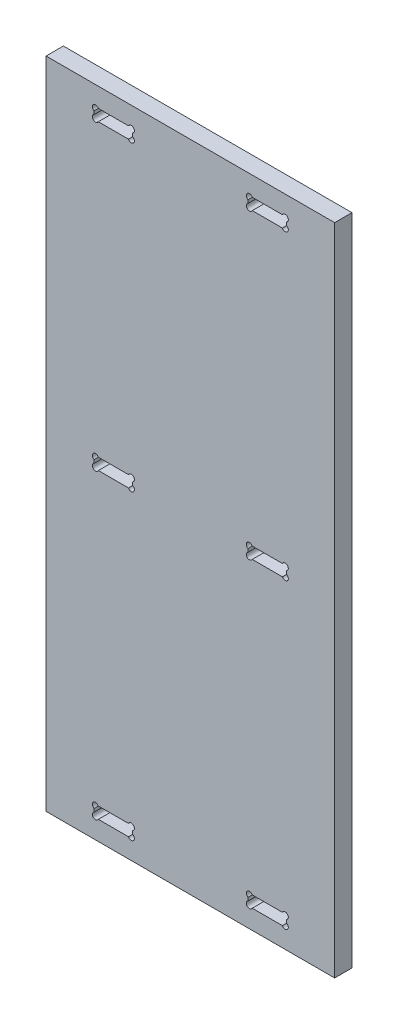
from build123d import *

# Parameters (mm, degrees)
BOSS_EXTRUDE1_DEPTH = 18


with BuildPart() as part:
    # Sketch1 → Boss-Extrude1 (new body)
    with BuildSketch(Plane.XY):
        Polygon((1280.062211089, 3439.241832817), (1280.062211089, 3419.241832817), (1280.062211089, 3407.241832817), (1280.062211089, 3105.241832817), (1280.062211089, 3093.241832817), (1280.062211089, 2791.241832817), (1280.062211089, 2779.241832817), (1280.062211089, 2759.241832817), (1580.062211089, 2759.241832817), (1580.062211089, 2779.241832817), (1580.062211089, 2791.241832817), (1580.062211089, 3093.241832817), (1580.062211089, 3105.241832817), (1580.062211089, 3407.241832817), (1580.062211089, 3419.241832817), (1580.062211089, 3439.241832817), align=None)
        with BuildLine():
            Line((1525.721822549, 3093.241832817), (1494.402599629, 3093.241832817))
            ThreePointArc((1494.402599629, 3093.241832817), (1489.178327612, 3092.357949341), (1490.062211089, 3097.582221357))
            Line((1490.062211089, 3097.582221357), (1490.062211089, 3100.901444277))
            ThreePointArc((1490.062211089, 3100.901444277), (1489.178327612, 3106.125716294), (1494.402599629, 3105.241832817))
            Line((1494.402599629, 3105.241832817), (1525.721822549, 3105.241832817))
            ThreePointArc((1525.721822549, 3105.241832817), (1530.946094565, 3106.125716294), (1530.062211089, 3100.901444277))
            Line((1530.062211089, 3100.901444277), (1530.062211089, 3097.582221357))
            ThreePointArc((1530.062211089, 3097.582221357), (1530.946094565, 3092.357949341), (1525.721822549, 3093.241832817))
        make_face(mode=Mode.SUBTRACT)
        with BuildLine():
            Line((1365.721822549, 2791.241832817), (1334.402599629, 2791.241832817))
            ThreePointArc((1334.402599629, 2791.241832817), (1329.178327612, 2792.125716294), (1330.062211089, 2786.901444277))
            Line((1330.062211089, 2786.901444277), (1330.062211089, 2783.582221357))
            ThreePointArc((1330.062211089, 2783.582221357), (1329.178327612, 2778.357949341), (1334.402599629, 2779.241832817))
            Line((1334.402599629, 2779.241832817), (1365.721822549, 2779.241832817))
            ThreePointArc((1365.721822549, 2779.241832817), (1370.946094565, 2778.357949341), (1370.062211089, 2783.582221357))
            Line((1370.062211089, 2783.582221357), (1370.062211089, 2786.901444277))
            ThreePointArc((1370.062211089, 2786.901444277), (1370.946094565, 2792.125716294), (1365.721822549, 2791.241832817))
        make_face(mode=Mode.SUBTRACT)
        with BuildLine():
            Line((1330.062211089, 3414.901444277), (1330.062211089, 3411.582221357))
            ThreePointArc((1330.062211089, 3411.582221357), (1329.178327612, 3406.357949341), (1334.402599629, 3407.241832817))
            Line((1334.402599629, 3407.241832817), (1365.721822549, 3407.241832817))
            ThreePointArc((1365.721822549, 3407.241832817), (1370.946094565, 3406.357949341), (1370.062211089, 3411.582221357))
            Line((1370.062211089, 3411.582221357), (1370.062211089, 3414.901444277))
            ThreePointArc((1370.062211089, 3414.901444277), (1370.946094565, 3420.125716294), (1365.721822549, 3419.241832817))
            Line((1365.721822549, 3419.241832817), (1334.402599629, 3419.241832817))
            ThreePointArc((1334.402599629, 3419.241832817), (1329.178327612, 3420.125716294), (1330.062211089, 3414.901444277))
        make_face(mode=Mode.SUBTRACT)
        with BuildLine():
            Line((1334.402599629, 3105.241832817), (1365.721822549, 3105.241832817))
            ThreePointArc((1365.721822549, 3105.241832817), (1370.946094565, 3106.125716294), (1370.062211089, 3100.901444277))
            Line((1370.062211089, 3100.901444277), (1370.062211089, 3097.582221357))
            ThreePointArc((1370.062211089, 3097.582221357), (1370.946094565, 3092.357949341), (1365.721822549, 3093.241832817))
            Line((1365.721822549, 3093.241832817), (1334.402599629, 3093.241832817))
            ThreePointArc((1334.402599629, 3093.241832817), (1329.178327612, 3092.357949341), (1330.062211089, 3097.582221357))
            Line((1330.062211089, 3097.582221357), (1330.062211089, 3100.901444277))
            ThreePointArc((1330.062211089, 3100.901444277), (1329.178327612, 3106.125716294), (1334.402599629, 3105.241832817))
        make_face(mode=Mode.SUBTRACT)
        with BuildLine():
            Line((1530.062211089, 2783.582221357), (1530.062211089, 2786.901444277))
            ThreePointArc((1530.062211089, 2786.901444277), (1530.946094565, 2792.125716294), (1525.721822549, 2791.241832817))
            Line((1525.721822549, 2791.241832817), (1494.402599629, 2791.241832817))
            ThreePointArc((1494.402599629, 2791.241832817), (1489.178327612, 2792.125716294), (1490.062211089, 2786.901444277))
            Line((1490.062211089, 2786.901444277), (1490.062211089, 2783.582221357))
            ThreePointArc((1490.062211089, 2783.582221357), (1489.178327612, 2778.357949341), (1494.402599629, 2779.241832817))
            Line((1494.402599629, 2779.241832817), (1525.721822549, 2779.241832817))
            ThreePointArc((1525.721822549, 2779.241832817), (1530.946094565, 2778.357949341), (1530.062211089, 2783.582221357))
        make_face(mode=Mode.SUBTRACT)
        with BuildLine():
            Line((1494.402599629, 3407.241832817), (1525.721822549, 3407.241832817))
            ThreePointArc((1525.721822549, 3407.241832817), (1530.946094565, 3406.357949341), (1530.062211089, 3411.582221357))
            Line((1530.062211089, 3411.582221357), (1530.062211089, 3414.901444277))
            ThreePointArc((1530.062211089, 3414.901444277), (1530.946094565, 3420.125716294), (1525.721822549, 3419.241832817))
            Line((1525.721822549, 3419.241832817), (1494.402599629, 3419.241832817))
            ThreePointArc((1494.402599629, 3419.241832817), (1489.178327612, 3420.125716294), (1490.062211089, 3414.901444277))
            Line((1490.062211089, 3414.901444277), (1490.062211089, 3411.582221357))
            ThreePointArc((1490.062211089, 3411.582221357), (1489.178327612, 3406.357949341), (1494.402599629, 3407.241832817))
        make_face(mode=Mode.SUBTRACT)
    extrude(amount=BOSS_EXTRUDE1_DEPTH)


solid = part.part
